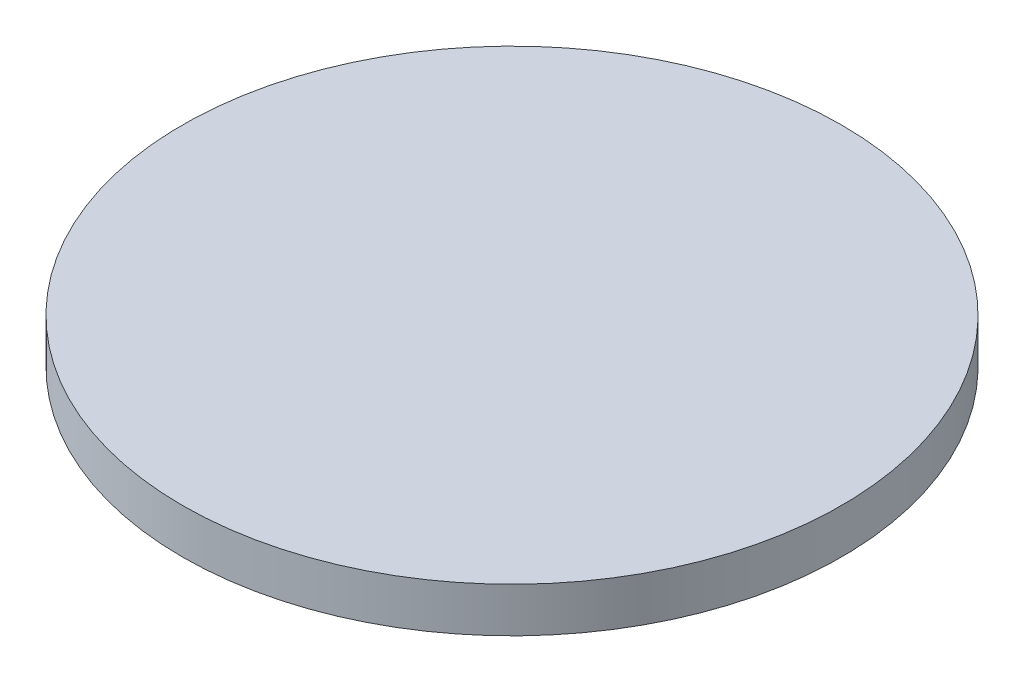
from build123d import *

# Parameters (mm, degrees)
SKETCH1_W           = 127.635
SKETCH1_H           = 127.635
BOSS_EXTRUDE1_DEPTH = 9.525
SKETCH13_R          = 93.6625
BOSS_EXTRUDE2_DEPTH = 12.7


with BuildPart() as part:
    # Sketch1 → Boss-Extrude1 (new body)
    with BuildSketch(Plane(origin=(0, 0, 0), x_dir=(1, 0, 0), z_dir=(0, 1, 0))):
        with Locations((63.8175, 63.8175)):
            Rectangle(SKETCH1_W, SKETCH1_H)
    extrude(amount=BOSS_EXTRUDE1_DEPTH)

    # Sketch13 → Boss-Extrude2 (add)
    with BuildSketch(Plane(origin=(0, 9.525, 0), x_dir=(1, 0, 0), z_dir=(0, 1, 0))):
        with Locations(Location((63.8175, 63.8175, 0), (0, 0, 270))):
            Circle(SKETCH13_R)
    extrude(amount=-BOSS_EXTRUDE2_DEPTH)


solid = part.part
